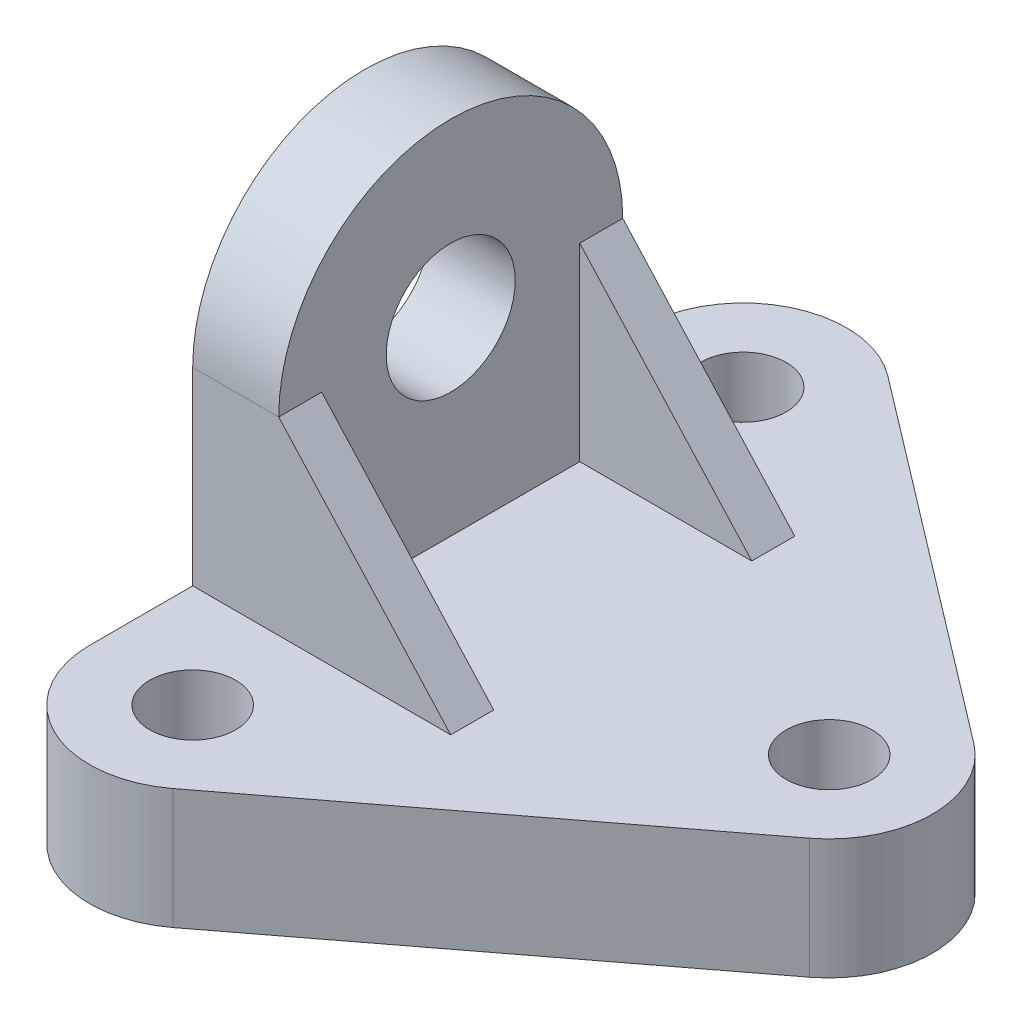
from build123d import *

# Parameters (mm, degrees)
SKETCH1_R           = 5
BOSS_EXTRUDE1_DEPTH = 14
SKETCH2_W           = 10
SKETCH2_H           = 40
BOSS_EXTRUDE2_DEPTH = 22
SKETCH4_R           = 20
BOSS_EXTRUDE3_DEPTH = 10
HOLE1_D             = 15
BOSS_EXTRUDE4_DEPTH = 5
BOSS_EXTRUDE5_DEPTH = 5


with BuildPart() as part:
    # Sketch1 → Boss-Extrude1 (new body)
    with BuildSketch(Plane(origin=(0, 0, 0), x_dir=(1, 0, 0), z_dir=(0, 1, 0))):
        with BuildLine():
            Line((-54, 32), (-54, -32))
            ThreePointArc((-54, -32), (-47.325869741, -42.753376749), (-34.727481417, -41.54518064))
            Line((-34.727481417, -41.54518064), (7.272518583, -9.54518064))
            ThreePointArc((7.272518583, -9.54518064), (12, 0), (7.272518583, 9.54518064))
            Line((7.272518583, 9.54518064), (-34.727481417, 41.54518064))
            ThreePointArc((-34.727481417, 41.54518064), (-47.325869741, 42.753376749), (-54, 32))
        make_face()
        with Locations(Location((-42, 32, 0), (0, 0, 270))):
            Circle(SKETCH1_R, mode=Mode.SUBTRACT)
        with Locations(Location((0, 0, 0), (0, 0, 270))):
            Circle(SKETCH1_R, mode=Mode.SUBTRACT)
        with Locations(Location((-42, -32, 0), (0, 0, 270))):
            Circle(SKETCH1_R, mode=Mode.SUBTRACT)
    extrude(amount=BOSS_EXTRUDE1_DEPTH)

    # Sketch2 → Boss-Extrude2 (add)
    with BuildSketch(Plane(origin=(0, 14, 0), x_dir=(1, 0, 0), z_dir=(0, 1, 0))):
        with Locations((-49, 0)):
            Rectangle(SKETCH2_W, SKETCH2_H)
    extrude(amount=BOSS_EXTRUDE2_DEPTH)

    # Sketch4 → Boss-Extrude3 (add)
    with BuildSketch(Plane.ZY.offset(54)):
        with Locations((0, 36)):
            Circle(SKETCH4_R)
    extrude(amount=-BOSS_EXTRUDE3_DEPTH)

    # Hole1 (through all)
    with Locations(Plane(origin=(-44, 0, 0), x_dir=(0, 0, -1), z_dir=(1, 0, 0))):
        with Locations((0, 36)):
            Hole(HOLE1_D / 2)

    # Sketch7 → Boss-Extrude4 (add)
    with BuildSketch(Plane.XY.offset(20)):
        Polygon((-44, 36), (-24, 14), (-44, 14), align=None)
    extrude(amount=-BOSS_EXTRUDE4_DEPTH)

    # Sketch8 → Boss-Extrude5 (add)
    with BuildSketch(Plane(origin=(0, 0, -20), x_dir=(-1, 0, 0), z_dir=(0, 0, -1))):
        Polygon((44, 36), (44, 14), (24, 14), align=None)
    extrude(amount=-BOSS_EXTRUDE5_DEPTH)


solid = part.part
